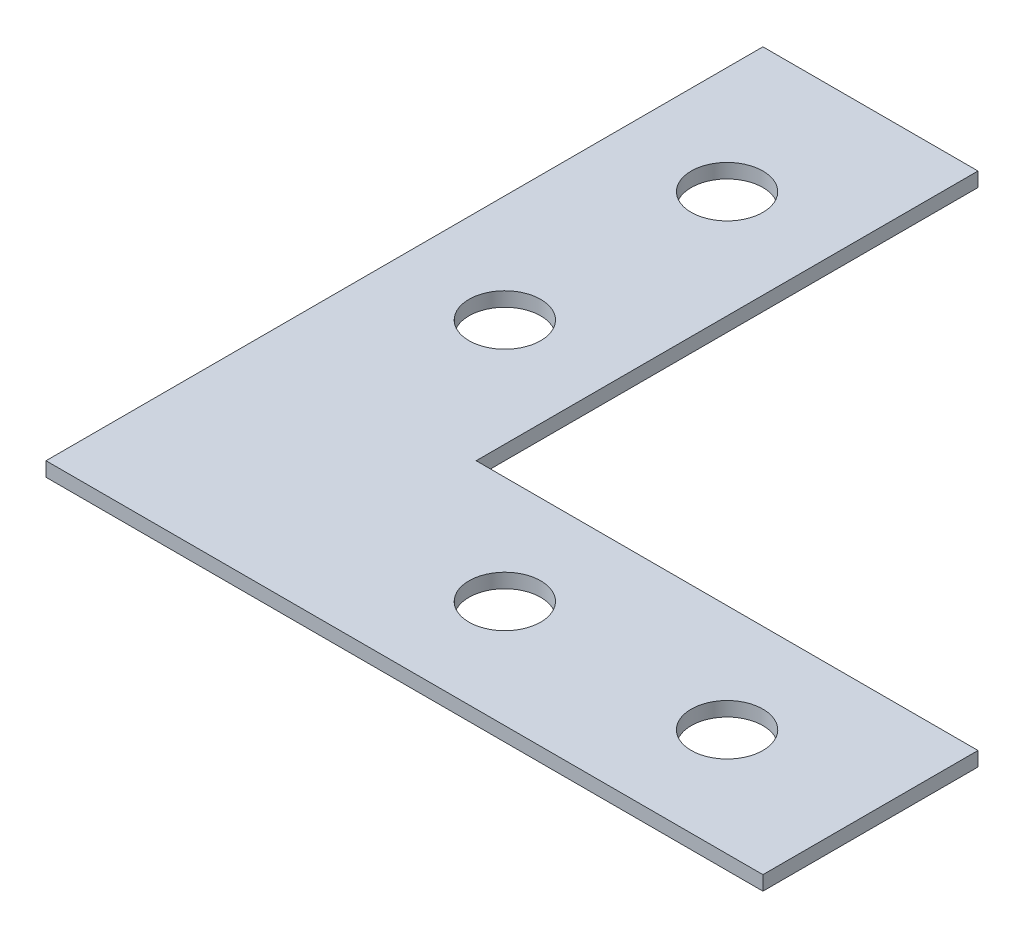
from build123d import *

# Parameters (mm, degrees)
BOSS_EXTRUDE1_DEPTH = 1
SKETCH4_R           = 2.5
CUT_EXTRUDE1_DEPTH  = 71.717748833


with BuildPart() as part:
    # Sketch2 → Boss-Extrude1 (new body)
    with BuildSketch(Plane(origin=(0, 0, 0), x_dir=(1, 0, 0), z_dir=(0, 1, 0))):
        Polygon((0, 0), (0, 50), (15, 50), (15, 15), (50, 15), (50, 0), align=None)
    extrude(amount=BOSS_EXTRUDE1_DEPTH)

    # Sketch4 → Cut-Extrude1 (cut, through all)
    with BuildSketch(Plane(origin=(0, 1, 0), x_dir=(1, 0, 0), z_dir=(0, 1, 0))):
        with Locations(Location((7.5, 40, 0), (0, 0, 270))):
            Circle(SKETCH4_R)
        with Locations(Location((7.5, 24.5, 0), (0, 0, 270))):
            Circle(SKETCH4_R)
        with Locations(Location((24.5, 7.5, 0), (0, 0, 270))):
            Circle(SKETCH4_R)
        with Locations(Location((40, 7.5, 0), (0, 0, 270))):
            Circle(SKETCH4_R)
    extrude(amount=-CUT_EXTRUDE1_DEPTH, mode=Mode.SUBTRACT)


solid = part.part
